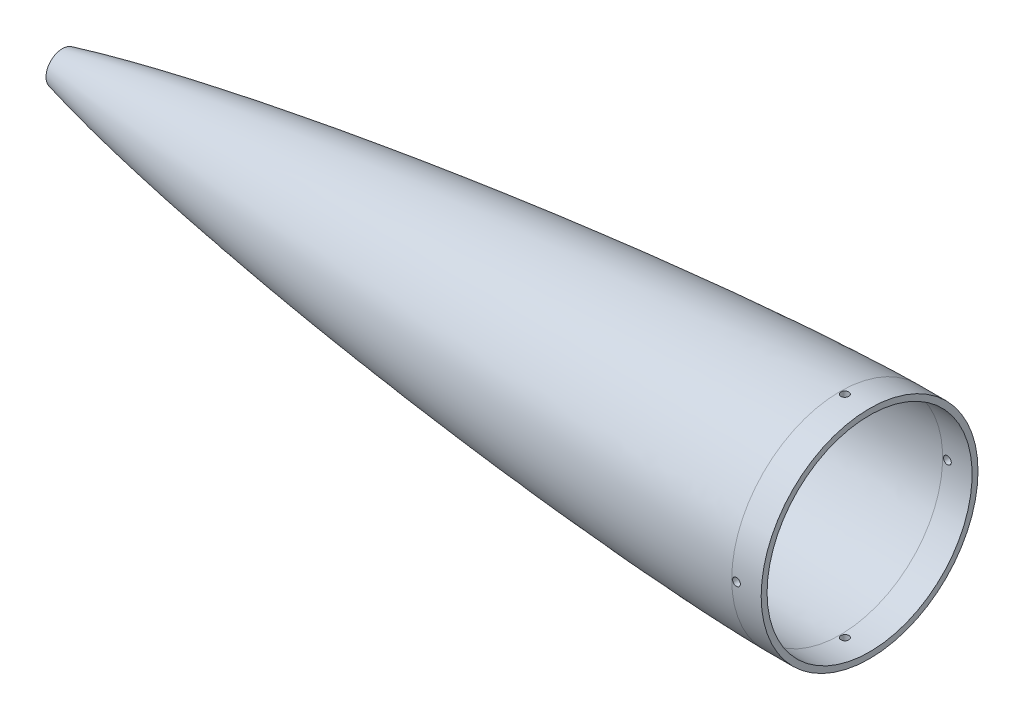
from build123d import *

# Parameters (mm, degrees)
SKETCH5_W                = 40
SKETCH5_H                = 13.888133248
M6_CLEARANCE_HOLE2_D     = 6.6
M6_CLEARANCE_HOLE2_DEPTH = 91.999994559
CIRPATTERN1_COUNT        = 4


with BuildPart() as part:
    # Sketch4 → Revolve1 (revolve)
    with BuildSketch(Plane(origin=(0, 0, 0), x_dir=(1, 0, 0), z_dir=(0, 1, 0)), mode=Mode.PRIVATE) as revolve1_sk:
        with BuildLine():
            Line((692.19493618, 92.00000544), (717.19493618, 92.00000544))
            Line((717.19493618, 92.00000544), (717.19493618, 87.00000544))
            Line((717.19493618, 87.00000544), (692.19493618, 87.00000544))
            add(Edge.make_bspline(
                [(2.35059049, 5.44e-06), (3.070313939, 0.264986511), (4.514288074, 0.783487004), (7.209892242, 1.71272979), (10.9691237, 2.926899076), (15.025999643, 4.169178684), (19.224986498, 5.38932061), (23.233126546, 6.512231978), (26.984670226, 7.528086742), (31.159300835, 8.62770031), (35.735645757, 9.796313018), (40.729438664, 11.033714423), (46.132501861, 12.331727167), (52.46606922, 13.811572152), (59.730707612, 15.455942991), (67.931249889, 17.250288118), (77.069064553, 19.180614263), (89.377084776, 21.6982277), (104.868830112, 24.732258394), (129.021466327, 29.228337817), (161.883300879, 34.909322194), (200.304373387, 41.042569148), (244.299268366, 47.493743387), (288.362460984, 53.459016593), (332.483108604, 58.982406869), (376.653772929, 64.089902823), (420.869252086, 68.79347324), (465.125844203, 73.093266185), (509.420974498, 76.976580594), (553.752951275, 80.415600393), (592.574876365, 82.990430422), (625.873181767, 84.828773072), (651.512715071, 85.95746689), (667.766937064, 86.523117155), (680.18468763, 86.841349022), (687.047375242, 86.957928013), (690.479030026, 86.995136708), (692.19493618, 87.00000544)],
                knots=[0.01508967, 0.01508967, 0.01508967, 0.01508967, 0.01508967, 0.019493048, 0.023896426, 0.030824307, 0.037752188, 0.043259562, 0.048766937, 0.054274311, 0.059781685, 0.06763902, 0.075496354, 0.083353689, 0.091211024, 0.104414263, 0.117617503, 0.130820743, 0.144023982, 0.175453359, 0.206882735, 0.2697415, 0.332600261, 0.395459022, 0.458317784, 0.521176544, 0.584035307, 0.646894069, 0.70975283, 0.772611593, 0.835470354, 0.898329117, 0.929758497, 0.961187877, 0.980593939, 0.990296969, 1, 1, 1, 1, 1], degree=4))
            Line((2.35059049, 5.44e-06), (-7.80506382, 5.44e-06))
            add(Edge.make_bspline(
                [(-7.80506382, 5.44e-06), (-7.80315235, 0.007457895), (-7.798381049, 0.021981107), (-7.784743909, 0.049410712), (-7.751351508, 0.100819332), (-7.698771277, 0.166570112), (-7.625702296, 0.244895734), (-7.483749653, 0.380311226), (-7.31524235, 0.519277796), (-7.123055524, 0.663624603), (-6.826823811, 0.869277302), (-6.423546949, 1.128296436), (-5.717398659, 1.540869703), (-4.452219139, 2.200385781), (-2.245701798, 3.217611314), (1.746367252, 4.830783645), (9.00566328, 7.377336299), (21.112361692, 11.039415964), (37.552247997, 15.359474608), (57.414690694, 20.019312814), (84.434531374, 25.797417052), (116.853732539, 32.080217567), (154.795304085, 38.763083388), (198.26939689, 45.728614504), (241.827760535, 52.143064754), (285.453924599, 58.077617211), (329.136957776, 63.576847497), (372.869529617, 68.666752974), (416.64639657, 73.360151742), (460.463880201, 77.658080534), (504.319365047, 81.549651766), (548.211132534, 85.009609026), (586.64732018, 87.618360709), (619.614541981, 89.502860955), (645.862960007, 90.726422777), (663.252200015, 91.380725004), (677.276118816, 91.780416652), (685.800677513, 91.941707564), (690.063435506, 91.993340793), (692.19493618, 92.00000544)],
                knots=[0, 0, 0, 0, 0, 4.3185e-05, 8.637e-05, 0.000172741, 0.000345481, 0.000518222, 0.000690962, 0.001280476, 0.001578086, 0.001875696, 0.002727788, 0.00398729, 0.006196413, 0.009932334, 0.016447975, 0.028301339, 0.049639657, 0.081363194, 0.112451539, 0.143539883, 0.205716599, 0.267893307, 0.330070016, 0.392246725, 0.454423434, 0.516600142, 0.578776854, 0.640953563, 0.703130272, 0.765306983, 0.827483692, 0.889660402, 0.920748757, 0.951837113, 0.975918556, 0.987959278, 1, 1, 1, 1, 1], degree=4))
        make_face()
    revolve(revolve1_sk.sketch.rotate(Axis((-7.80506382, 0, -5.44e-06), (1, 0, 0)), 180), axis=Axis((-7.80506382, 0, -5.44e-06), (1, 0, 0)))


with BuildPart() as body_2:
    # Sketch5 → Revolve4 (revolve)
    with BuildSketch(Plane(origin=(0, 0, 0), x_dir=(1, 0, 0), z_dir=(0, 1, 0)), mode=Mode.PRIVATE) as revolve4_sk:
        with Locations((12.19493618, 6.944072064)):
            Rectangle(SKETCH5_W, SKETCH5_H)
    revolve(revolve4_sk.sketch.rotate(Axis((-7.80506382, 0, -5.44e-06), (1, 0, 0)), 180), axis=Axis((-7.80506382, 0, -5.44e-06), (1, 0, 0)))


with BuildPart() as part_1:
    add(part.part)

    # Combine2: cut body 2
    add(body_2.part, mode=Mode.SUBTRACT)

    # M6 Clearance Hole2
    with Locations(Plane(origin=(696.220083154, 91.999999914, 0.003962383), x_dir=(0, -4.3128514e-05, 0.99999999907), z_dir=(0, 0.99999999907, 4.3128514e-05))):
        with Locations((0, 0)):
            m6_clearance_hole2 = Hole(M6_CLEARANCE_HOLE2_D / 2, depth=M6_CLEARANCE_HOLE2_DEPTH)

    # CirPattern1: M6 Clearance Hole2 ×4 about axis
    cirpattern1_axis = Axis((-7.80506382, 0, -5.44e-06), (-1, 0, 0))
    for i in range(1, CIRPATTERN1_COUNT):
        add(m6_clearance_hole2.rotate(cirpattern1_axis, i * 360 / CIRPATTERN1_COUNT), mode=Mode.SUBTRACT)


solid = part_1.part
